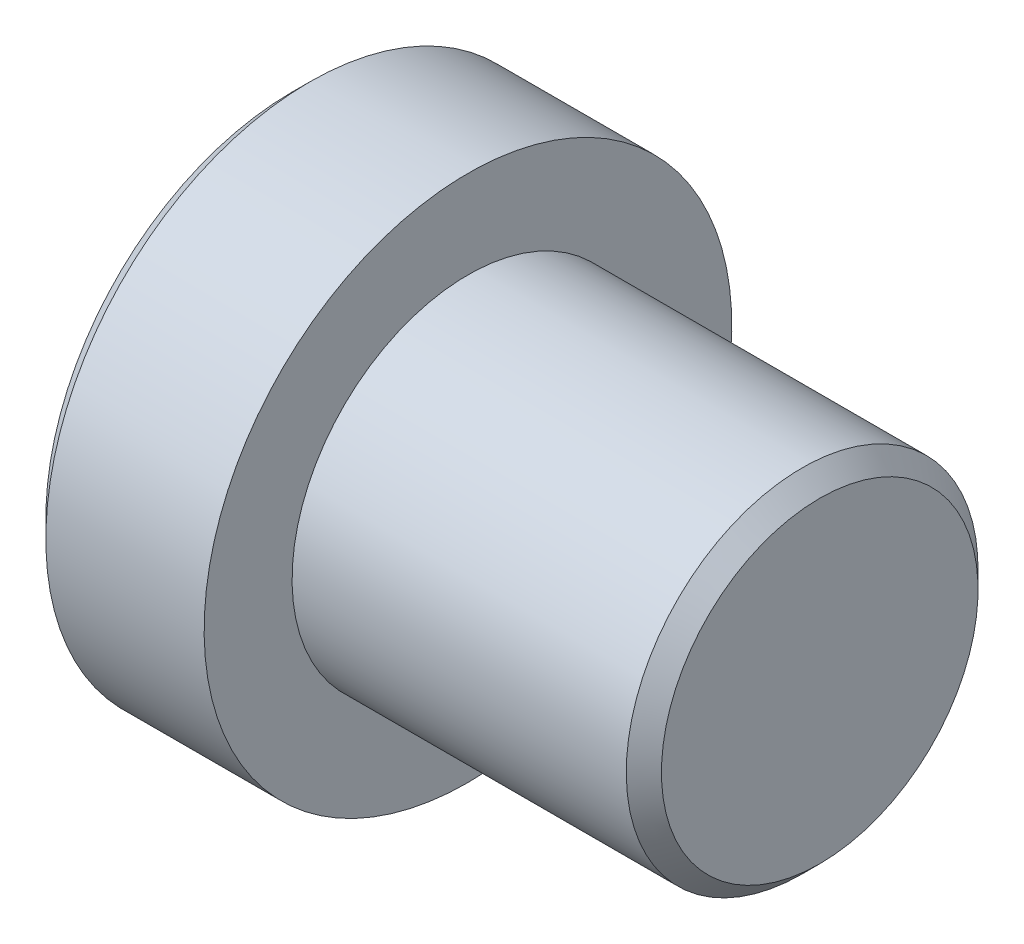
from build123d import *

# Parameters (mm, degrees)
CUT_EXTRUDE1_DEPTH = 1.5
CHAMFER1_SIZE      = 0.2


with BuildPart() as part:
    # Sketch1 → Revolve1 (revolve)
    with BuildSketch(Plane.XY, mode=Mode.PRIVATE) as revolve1_sk:
        Polygon((0, 0), (0, 3), (2, 3), (2, 2), (6, 2), (6, 0), align=None)
    revolve(revolve1_sk.sketch.rotate(Axis((0, 0, 0), (1, 0, 0)), 180), axis=Axis((0, 0, 0), (1, 0, 0)))

    # Sketch2 → Cut-Extrude1 (cut)
    with BuildSketch(Plane.ZY):
        Polygon((0, 2), (-1.732050808, 1), (-1.732050808, -1), (0, -2), (1.732050808, -1), (1.732050808, 1), align=None)
    extrude(amount=-CUT_EXTRUDE1_DEPTH, mode=Mode.SUBTRACT)

    # Chamfer1
    chamfer1_edges = [part.edges().sort_by_distance(p)[0] for p in [
        (6, 2, 0),
        (0, 3, 0),
    ]]
    chamfer(chamfer1_edges, length=CHAMFER1_SIZE)


solid = part.part
